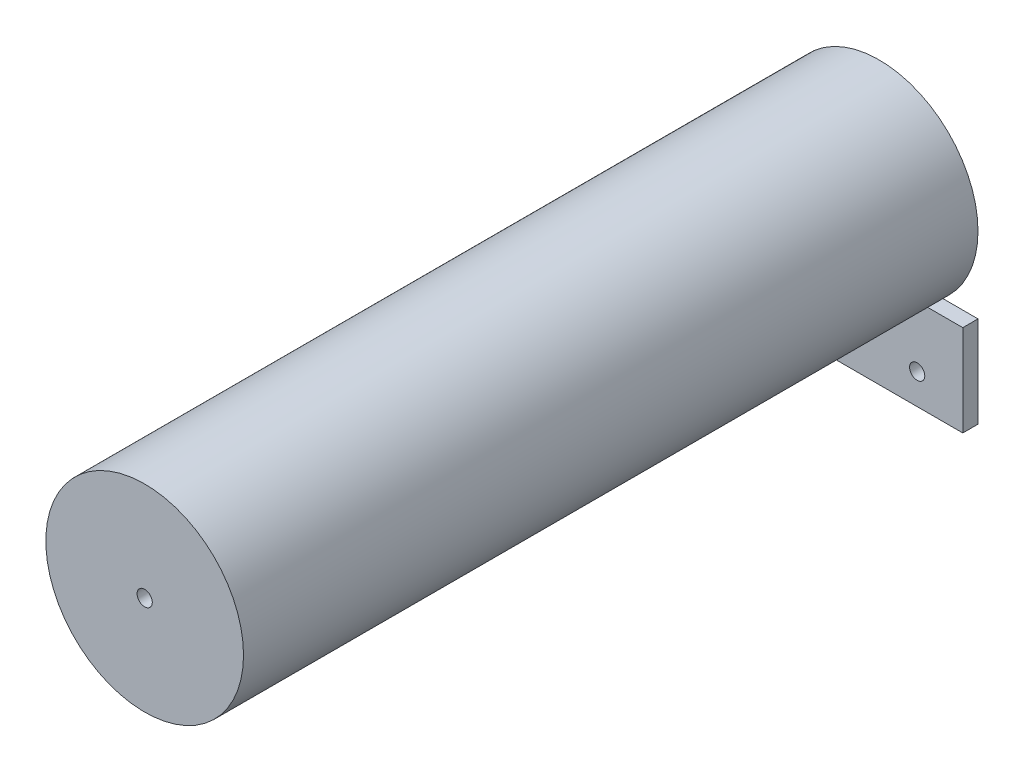
from build123d import *

# Parameters (mm, degrees)
EXTRUDEASSE_DEPTH      = 468
EXTRUDEASSE_DEPTH_BACK = 15
SKETCH1_R              = 65
SKETCH6_W              = 125.765742684
SKETCH6_H              = 20
CUT_EXTRUDE1_DEPTH     = 10
SKETCH7_W              = 70
SKETCH7_H              = 10
EXTRPIASTRINA_DEPTH    = 60
SKETCH8_R              = 5
FORO_DEPTH             = 10


with BuildPart() as part:
    # Sketch1 → ExtrudeAsse (new, two sides: drawn at the far end of the back side and taken through both)
    with BuildSketch(Plane.XY.offset(-EXTRUDEASSE_DEPTH_BACK)):
        Circle(SKETCH1_R)
    extrude(amount=EXTRUDEASSE_DEPTH + EXTRUDEASSE_DEPTH_BACK)

    # Sketch3 → Cut-Revolve1 (revolve, cut)
    with BuildSketch(Plane(origin=(0, 0, 0), x_dir=(0, 0, -1), z_dir=(1, 0, 0)), mode=Mode.PRIVATE) as cut_revolve1_sk:
        Polygon((-335.5, -65), (-335.5, 10), (-340.5, 12.886751346), (-340.5, 10), (-340.5, -65), align=None)
    revolve(cut_revolve1_sk.sketch.rotate(Axis((0, 12.886751346, 340.5), (0, -1, 0)), 180), axis=Axis((0, 12.886751346, 340.5), (0, -1, 0)), mode=Mode.SUBTRACT)

    # Sketch3<3> → Cut-Revolve2 (revolve, cut)
    with BuildSketch(Plane(origin=(0, 0, 0), x_dir=(0, 0, -1), z_dir=(1, 0, 0)), mode=Mode.PRIVATE) as cut_revolve2_sk:
        Polygon((-232.7, -65), (-227.7, -65), (-227.7, 10), (-232.7, 12.886751346), (-232.7, 0), align=None)
    revolve(cut_revolve2_sk.sketch.rotate(Axis((0, 0, 232.7), (0, -1, 0)), 180), axis=Axis((0, 0, 232.7), (0, -1, 0)), mode=Mode.SUBTRACT)

    # Sketch4 → Cut-Revolve5 (revolve, cut)
    with BuildSketch(Plane(origin=(0, 0, 0), x_dir=(0, 0, -1), z_dir=(1, 0, 0)), mode=Mode.PRIVATE) as cut_revolve5_sk:
        Polygon((-468, 0), (-197.77110668, 0), (-194.884355334, 0), (-197.77110668, -5), (-468, -5), align=None)
    revolve(cut_revolve5_sk.sketch.rotate(Axis((0, 0, 0), (0, 0, 1)), 270), axis=Axis((0, 0, 0), (0, 0, 1)), mode=Mode.SUBTRACT)

    # Sketch5 → Cut-Revolve6 (revolve, cut)
    with BuildSketch(Plane(origin=(0, 0, 0), x_dir=(0, 0, -1), z_dir=(1, 0, 0)), mode=Mode.PRIVATE) as cut_revolve6_sk:
        Polygon((15, -5), (15, 0), (-162.113248654, 0), (-165, 0), (-162.113248654, -5), align=None)
    revolve(cut_revolve6_sk.sketch.rotate(Axis((0, 0, 0), (0, 0, 1)), 90), axis=Axis((0, 0, 0), (0, 0, 1)), mode=Mode.SUBTRACT)

    # Sketch3<5> → Cut-Revolve7 (revolve, cut)
    with BuildSketch(Plane(origin=(0, 0, 0), x_dir=(0, 0, -1), z_dir=(1, 0, 0))):
        Polygon((-124.9, 10), (-124.9, 12.886751346), (-119.9, 10), (-119.9, -65), (-124.9, -65), align=None)
    revolve(axis=Axis((0, -65, 124.9), (0, 1, 0)), mode=Mode.SUBTRACT)

    # Sketch6 → Cut-Extrude1 (cut)
    with BuildSketch(Plane(origin=(0, 0, 0), x_dir=(-1, 0, 0), z_dir=(0, 0, -1))):
        with Locations((-8.867505506, -55)):
            Rectangle(SKETCH6_W, SKETCH6_H)
    extrude(amount=CUT_EXTRUDE1_DEPTH, mode=Mode.SUBTRACT)


with BuildPart() as body_2:
    # Sketch7 → ExtrPiastrina (new body)
    with BuildSketch(Plane.XZ.offset(45)):
        with Locations((-35, -5)):
            Rectangle(SKETCH7_W, SKETCH7_H)
    extrude(amount=EXTRPIASTRINA_DEPTH)

    # Sketch8 → Foro (cut)
    with BuildSketch(Plane(origin=(0, 0, -10), x_dir=(-1, 0, 0), z_dir=(0, 0, -1))):
        with Locations((40, -85)):
            Circle(SKETCH8_R)
    extrude(amount=-FORO_DEPTH, mode=Mode.SUBTRACT)

    # Mirror1: body 2 across plane


with BuildPart() as body_2_1:
    add(body_2.part)
    add(body_2.part.mirror(Plane(origin=(0, -105, -10), x_dir=(0, 0, 1), z_dir=(-1, 0, 0))))


solid = Compound([part.part, body_2_1.part])
